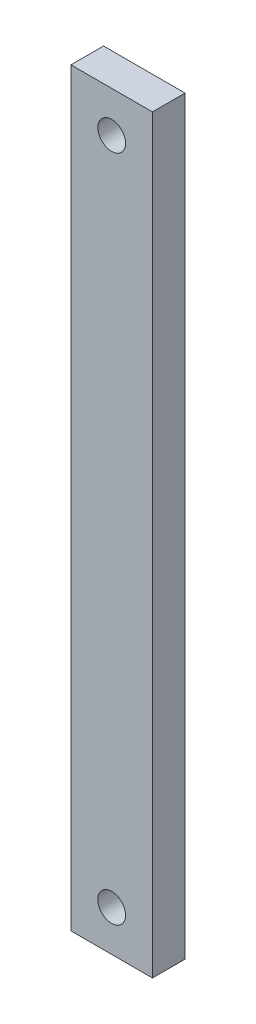
from build123d import *

# Parameters (mm, degrees)
CONTROL_BATTERY_CLAMP_START = 94
SKETCH_1_W                  = 10
SKETCH_1_H                  = 92
CONTROL_BATTERY_CLAMP_DEPTH = 4
CLAMP_TWO_M3_START          = 99
SKETCH_2_R                  = 1.7
CLAMP_TWO_M3_DEPTH          = 6


with BuildPart() as part:
    # 草图1 → Control_battery_clamp (new body)
    with BuildSketch(Plane.XY.offset(CONTROL_BATTERY_CLAMP_START)):
        with Locations((80, 0)):
            Rectangle(SKETCH_1_W, SKETCH_1_H)
    extrude(amount=CONTROL_BATTERY_CLAMP_DEPTH)

    # 草图2 → Clamp_two_M3 (cut)
    with BuildSketch(Plane.XY.offset(CLAMP_TWO_M3_START)):
        with Locations(Location((80, -41, 0), (0, 0, 180))):
            Circle(SKETCH_2_R)
        with Locations(Location((80, 41, 0), (0, 0, 180))):
            Circle(SKETCH_2_R)
    extrude(amount=-CLAMP_TWO_M3_DEPTH, mode=Mode.SUBTRACT)


solid = part.part
